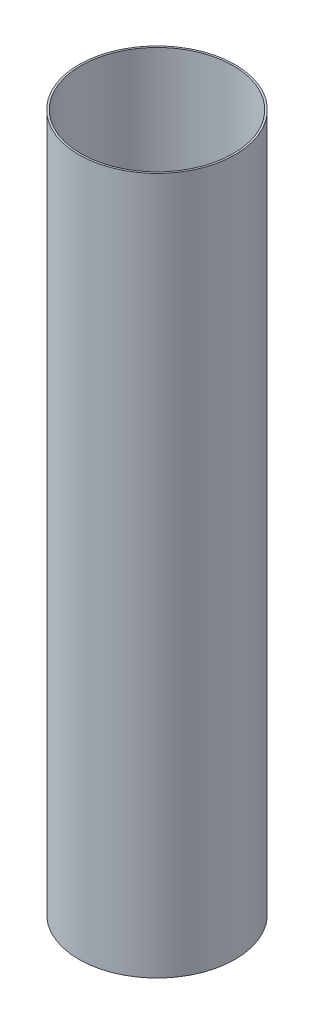
from build123d import *

# Parameters (mm, degrees)
SKETCH1_R           = 68
SKETCH1_R_2         = 63
BOSS_EXTRUDE1_DEPTH = 200
SCALE1_SCALE        = 0.560294118
CUT_EXTRUDE1_START  = -10
SKETCH2_R           = 38.1
SKETCH2_R_2         = 36.048529411
CUT_EXTRUDE1_DEPTH  = 10
BOSS_EXTRUDE2_START = 237.94
SKETCH3_R           = 38.1
SKETCH3_R_2         = 35.298529411
BOSS_EXTRUDE2_DEPTH = 237.94
SKETCH4_R           = 37.2
CUT_EXTRUDE2_DEPTH  = 349.998823528


with BuildPart() as part:
    # Sketch1 → Boss-Extrude1 (new body)
    with BuildSketch(Plane(origin=(0, 0, 0), x_dir=(1, 0, 0), z_dir=(0, 1, 0))):
        with Locations(Location((0, 0, 0), (0, 0, 270))):
            Circle(SKETCH1_R)
        with Locations(Location((0, 0, 0), (0, 0, 270))):
            Circle(SKETCH1_R_2, mode=Mode.SUBTRACT)
    extrude(amount=BOSS_EXTRUDE1_DEPTH)


with BuildPart() as part_1:
    # Scale1: scaled about (0, 100, 0)
    add(part.part.scale(SCALE1_SCALE).moved(Location((0, 43.970588236, 0))))

    # Sketch2 → Cut-Extrude1 (cut)
    with BuildSketch(Plane(origin=(0, 156.029411764, 0), x_dir=(1, 0, 0), z_dir=(0, 1, 0)).offset(CUT_EXTRUDE1_START)):
        with Locations(Location((0, 0, 0), (0, 0, 270))):
            Circle(SKETCH2_R)
        with Locations(Location((0, 0, 0), (0, 0, 270))):
            Circle(SKETCH2_R_2, mode=Mode.SUBTRACT)
    extrude(amount=CUT_EXTRUDE1_DEPTH, mode=Mode.SUBTRACT)

    # Sketch3 → Boss-Extrude2 (add)
    with BuildSketch(Plane.XZ.offset(-43.970588236).offset(BOSS_EXTRUDE2_START)):
        with Locations(Location((0, 0, 0), (0, 0, 270))):
            Circle(SKETCH3_R)
        with Locations(Location((0, 0, 0), (0, 0, 270))):
            Circle(SKETCH3_R_2, mode=Mode.SUBTRACT)
    extrude(amount=-BOSS_EXTRUDE2_DEPTH)

    # Sketch4 → Cut-Extrude2 (cut)
    with BuildSketch(Plane.XZ.offset(193.969411764)):
        with Locations(Location((0, 0, 0), (0, 0, 270))):
            Circle(SKETCH4_R)
    extrude(amount=-CUT_EXTRUDE2_DEPTH, mode=Mode.SUBTRACT)


solid = part_1.part
